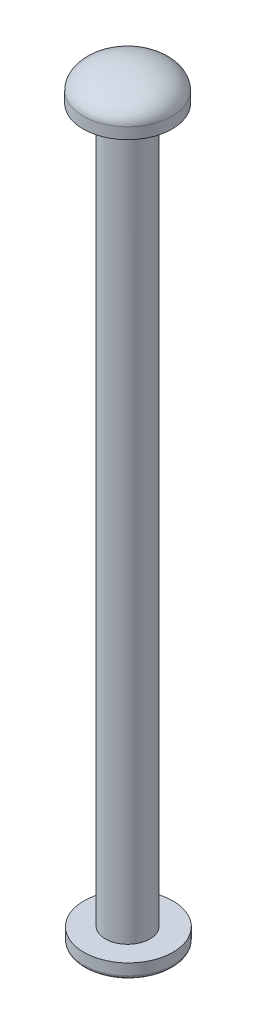
from build123d import *

# Parameters (mm, degrees)
SKETCH1_R                  = 1
MAIN_BODY_OF_SCREW_DEPTH   = 32
SKETCH2_R                  = 2
TOP_EXTRUDE_DEPTH          = 0.5
DOME_AT_TOP_FACE_RADIUS    = 2
DOME_AT_TOP_HEIGHT         = 1
SKETCH3_R                  = 2
BOTTOM_EXTRUDE_DEPTH       = 0.5
DOME_AT_BOTTOM_FACE_RADIUS = 2
DOME_AT_BOTTOM_HEIGHT      = 0.5


with BuildPart() as part:
    # Sketch1 → Main Body of Screw (new body)
    with BuildSketch(Plane(origin=(0, 0, 0), x_dir=(1, 0, 0), z_dir=(0, 1, 0))):
        Circle(SKETCH1_R)
    extrude(amount=MAIN_BODY_OF_SCREW_DEPTH)

    # Sketch2 → Top Extrude (add)
    with BuildSketch(Plane(origin=(0, 32, 0), x_dir=(1, 0, 0), z_dir=(0, 1, 0))):
        Circle(SKETCH2_R)
    extrude(amount=TOP_EXTRUDE_DEPTH)

    # Dome at Top: an elliptical dome of height H over a round flat face of radius A is half a spheroid: the quarter ellipse of half axes A and H revolved about the face's axis
    with BuildSketch(Plane((0, 32.5, 0), x_dir=(0, 0, -1), z_dir=(1, 0, 0)), mode=Mode.PRIVATE) as dome_at_top_quarter:
        Ellipse(DOME_AT_TOP_FACE_RADIUS, DOME_AT_TOP_HEIGHT)
        Rectangle(DOME_AT_TOP_FACE_RADIUS, DOME_AT_TOP_HEIGHT, align=(Align.MIN, Align.MIN), mode=Mode.INTERSECT)
    revolve(dome_at_top_quarter.sketch, axis=Axis((0, 32.5, 0), (0, 1, 0)))

    # Sketch3 → Bottom Extrude (add)
    with BuildSketch(Plane.XZ):
        with Locations((0.033817747, 0)):
            Circle(SKETCH3_R)
    extrude(amount=BOTTOM_EXTRUDE_DEPTH)

    # Dome at Bottom: an elliptical dome of height H over a round flat face of radius A is half a spheroid: the quarter ellipse of half axes A and H revolved about the face's axis
    with BuildSketch(Plane((0.033817747, -0.5, 0), x_dir=(0, 0, 1), z_dir=(1, 0, 0)), mode=Mode.PRIVATE) as dome_at_bottom_quarter:
        Ellipse(DOME_AT_BOTTOM_FACE_RADIUS, DOME_AT_BOTTOM_HEIGHT)
        Rectangle(DOME_AT_BOTTOM_FACE_RADIUS, DOME_AT_BOTTOM_HEIGHT, align=(Align.MIN, Align.MIN), mode=Mode.INTERSECT)
    revolve(dome_at_bottom_quarter.sketch, axis=Axis((0.033817747, -0.5, 0), (0, -1, 0)))


solid = part.part
